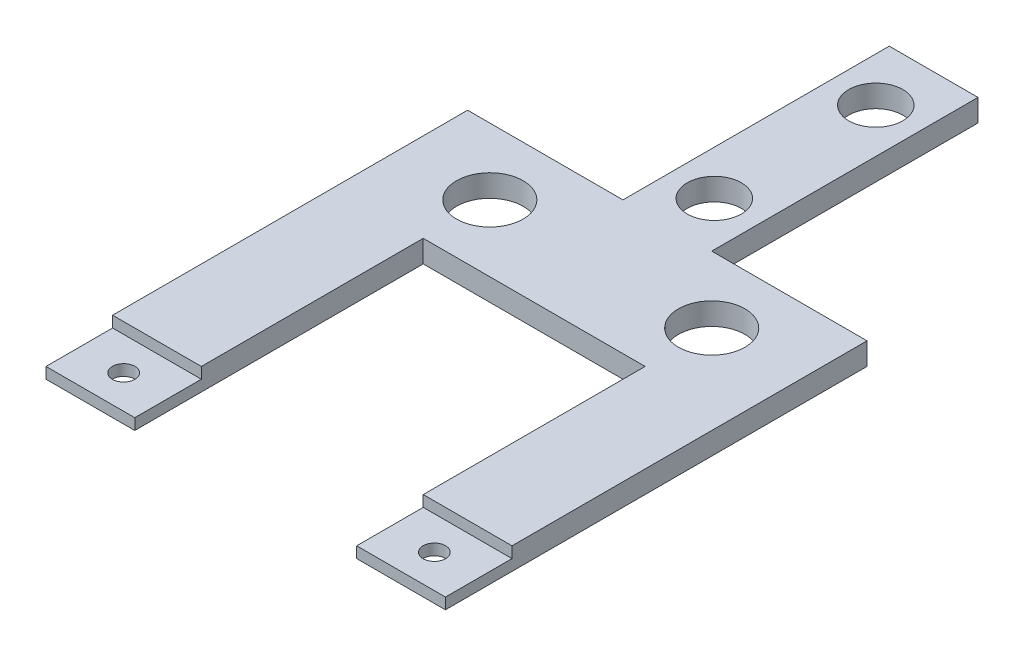
from build123d import *

# Parameters (mm, degrees)
SKETCH1_W           = 6.35
SKETCH1_H           = 19.05
BOSS_EXTRUDE1_DEPTH = 0.79375
SKETCH2_W           = 6.35
SKETCH2_H           = 4.7625
CUT_EXTRUDE1_DEPTH  = 0.79375
SKETCH3_R           = 0.80645
SKETCH3_R_2         = 2.38125
SKETCH3_R_3         = 1.936420783
CUT_EXTRUDE2_DEPTH  = 1.5875


with BuildPart() as part:
    # Sketch1 → Boss-Extrude1 (new, symmetric)
    with BuildSketch(Plane(origin=(0, 0, 0), x_dir=(1, 0, 0), z_dir=(0, 1, 0))):
        Polygon((-3.175, 15.08125), (-14.2875, 15.08125), (-14.2875, -15.08125), (-7.9375, -15.08125), (-7.9375, 5.55625), (7.9375, 5.55625), (7.9375, -15.08125), (14.2875, -15.08125), (14.2875, 15.08125), (3.175, 15.08125), align=None)
        with Locations((0, 24.60625)):
            Rectangle(SKETCH1_W, SKETCH1_H)
    extrude(amount=BOSS_EXTRUDE1_DEPTH, both=True)

    # Sketch2 → Cut-Extrude1 (cut)
    with BuildSketch(Plane(origin=(0, 0.79375, 0), x_dir=(1, 0, 0), z_dir=(0, 1, 0))):
        with Locations((-11.1125, -12.7)):
            Rectangle(SKETCH2_W, SKETCH2_H)
        with Locations((11.1125, -12.7)):
            Rectangle(SKETCH2_W, SKETCH2_H)
    extrude(amount=-CUT_EXTRUDE1_DEPTH, mode=Mode.SUBTRACT)

    # Sketch3 → Cut-Extrude2 (cut)
    with BuildSketch(Plane(origin=(0, 0.79375, 0), x_dir=(1, 0, 0), z_dir=(0, 1, 0))):
        with Locations(Location((-11.1125, -12.7, 0), (0, 0, 270))):
            Circle(SKETCH3_R)
        with Locations(Location((-7.9375, 10.31875, 0), (0, 0, 270))):
            Circle(SKETCH3_R_2)
        with Locations(Location((11.1125, -12.7, 0), (0, 0, 270))):
            Circle(SKETCH3_R)
        with Locations(Location((7.9375, 10.31875, 0), (0, 0, 270))):
            Circle(SKETCH3_R_2)
        with Locations(Location((0, 18.44201602, 0), (0, 0, 270))):
            Circle(SKETCH3_R_3)
        with Locations(Location((0, 29.994029814, 0), (0, 0, 270))):
            Circle(SKETCH3_R_3)
    extrude(amount=-CUT_EXTRUDE2_DEPTH, mode=Mode.SUBTRACT)


solid = part.part
